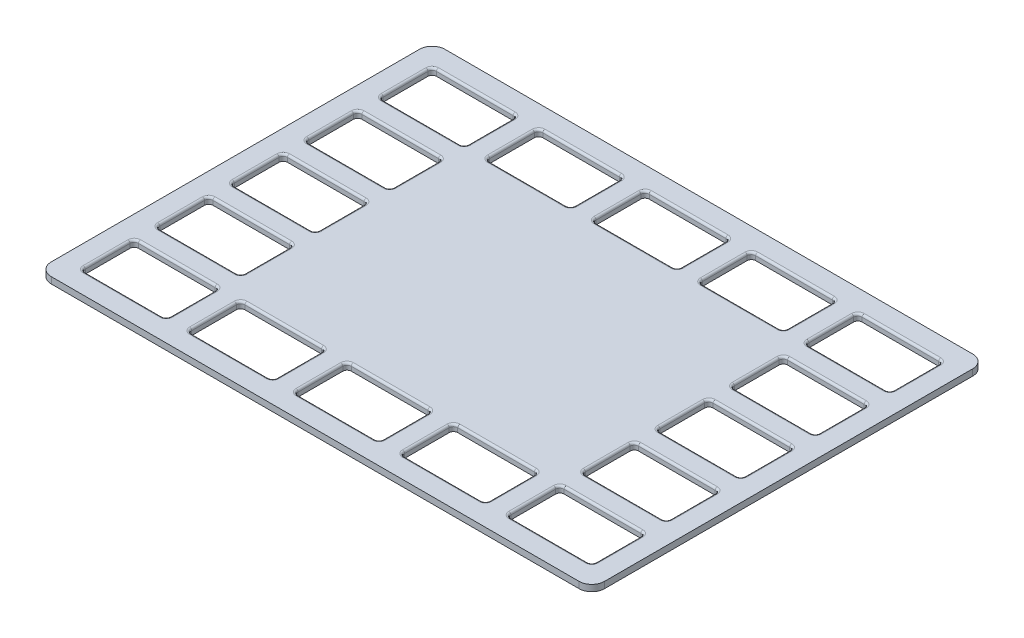
from build123d import *

# Parameters (mm, degrees)
SKETCH1_W                     = 260
SKETCH1_H                     = 185
EXTRUDE1_DEPTH                = 3
FILLET3_R                     = 6
SKETCH2_W                     = 40
SKETCH2_H                     = 25
CUT_EXTRUDE1_DEPTH            = 320.11439955
FILLET1_R                     = 2
FILLET2_R                     = 1
PATTERN_LINEAR_1_COUNT        = 5
PATTERN_LINEAR_1_PITCH        = 50
PATTERN_LINEAR_1_COUNT_DIR2   = 5
PATTERN_LINEAR_1_PITCH_DIR2   = 35
FILLET1_OF_PATTERN_LINEAR_1_R = 2
FILLET2_OF_PATTERN_LINEAR_1_R = 1


with BuildPart() as part:
    # Sketch1 → Extrude1 (new body)
    with BuildSketch(Plane(origin=(0, 0, 0), x_dir=(1, 0, 0), z_dir=(0, 1, 0))):
        with Locations((130, 92.5)):
            Rectangle(SKETCH1_W, SKETCH1_H)
    extrude(amount=EXTRUDE1_DEPTH)

    # Fillet3
    fillet3_edges = [part.edges().sort_by_distance(p)[0] for p in [
        (0, 1.5, -185),
        (260, 1.5, -185),
        (260, 1.5, 0),
        (0, 1.5, 0),
    ]]
    fillet(fillet3_edges, radius=FILLET3_R)

    # Sketch2 → Cut-Extrude1 (cut, through all)
    with BuildSketch(Plane(origin=(0, 3, 0), x_dir=(-1, 0, 0), z_dir=(0, 1, 0))):
        with Locations((-30, -22.5)):
            Rectangle(SKETCH2_W, SKETCH2_H)
    cut_extrude1 = extrude(amount=-CUT_EXTRUDE1_DEPTH, mode=Mode.SUBTRACT)

    # Fillet1
    fillet1_edges = [part.edges().sort_by_distance(p)[0] for p in [
        (10, 1.5, -10),
        (10, 1.5, -35),
        (50, 1.5, -35),
        (50, 1.5, -10),
    ]]
    fillet(fillet1_edges, radius=FILLET1_R)

    # Fillet2
    fillet2_edges = [part.edges().sort_by_distance(p)[0] for p in [
        (30, 3, -35),
        (50, 3, -22.5),
        (30, 3, -10),
        (10, 3, -22.5),
        (49.414213562, 3, -34.414213562),
        (49.414213562, 3, -10.585786438),
        (10.585786438, 3, -10.585786438),
        (10.585786438, 3, -34.414213562),
    ]]
    fillet(fillet2_edges, radius=FILLET2_R)

    # 直線複製排列1: Cut-Extrude1 5 × 5, 9 skipped
    with Locations(*[(i * PATTERN_LINEAR_1_PITCH, 0, -j * PATTERN_LINEAR_1_PITCH_DIR2) for i in range(PATTERN_LINEAR_1_COUNT) for j in range(PATTERN_LINEAR_1_COUNT_DIR2) if (i, j) not in ((0, 0), (1, 1), (1, 2), (1, 3), (2, 1), (2, 2), (2, 3), (3, 1), (3, 2), (3, 3))]):
        add(cut_extrude1, mode=Mode.SUBTRACT)

    # Fillet1 of 直線複製排列1
    fillet1_of_pattern_linear_1_edges = [part.edges().sort_by_distance(p)[0] for p in [
        (10, 1.5, -45),
        (10, 1.5, -70),
        (50, 1.5, -70),
        (50, 1.5, -45),
        (10, 1.5, -80),
        (10, 1.5, -105),
        (50, 1.5, -105),
        (50, 1.5, -80),
        (10, 1.5, -115),
        (10, 1.5, -140),
        (50, 1.5, -140),
        (50, 1.5, -115),
        (10, 1.5, -150),
        (10, 1.5, -175),
        (50, 1.5, -175),
        (50, 1.5, -150),
        (60, 1.5, -10),
        (60, 1.5, -35),
        (100, 1.5, -35),
        (100, 1.5, -10),
        (60, 1.5, -150),
        (60, 1.5, -175),
        (100, 1.5, -175),
        (100, 1.5, -150),
        (110, 1.5, -10),
        (110, 1.5, -35),
        (150, 1.5, -35),
        (150, 1.5, -10),
        (110, 1.5, -150),
        (110, 1.5, -175),
        (150, 1.5, -175),
        (150, 1.5, -150),
        (160, 1.5, -10),
        (160, 1.5, -35),
        (200, 1.5, -35),
        (200, 1.5, -10),
        (160, 1.5, -150),
        (160, 1.5, -175),
        (200, 1.5, -175),
        (200, 1.5, -150),
        (210, 1.5, -10),
        (210, 1.5, -35),
        (250, 1.5, -35),
        (250, 1.5, -10),
        (210, 1.5, -45),
        (210, 1.5, -70),
        (250, 1.5, -70),
        (250, 1.5, -45),
        (210, 1.5, -80),
        (210, 1.5, -105),
        (250, 1.5, -105),
        (250, 1.5, -80),
        (210, 1.5, -115),
        (210, 1.5, -140),
        (250, 1.5, -140),
        (250, 1.5, -115),
        (210, 1.5, -150),
        (210, 1.5, -175),
        (250, 1.5, -175),
        (250, 1.5, -150),
    ]]
    fillet(fillet1_of_pattern_linear_1_edges, radius=FILLET1_OF_PATTERN_LINEAR_1_R)

    # Fillet2 of 直線複製排列1
    fillet2_of_pattern_linear_1_edges = [part.edges().sort_by_distance(p)[0] for p in [
        (30, 3, -70),
        (50, 3, -57.5),
        (30, 3, -45),
        (10, 3, -57.5),
        (49.414213562, 3, -69.414213562),
        (49.414213562, 3, -45.585786438),
        (10.585786438, 3, -45.585786438),
        (10.585786438, 3, -69.414213562),
        (30, 3, -105),
        (50, 3, -92.5),
        (30, 3, -80),
        (10, 3, -92.5),
        (49.414213562, 3, -104.414213562),
        (49.414213562, 3, -80.585786438),
        (10.585786438, 3, -80.585786438),
        (10.585786438, 3, -104.414213562),
        (30, 3, -140),
        (50, 3, -127.5),
        (30, 3, -115),
        (10, 3, -127.5),
        (49.414213562, 3, -139.414213562),
        (49.414213562, 3, -115.585786438),
        (10.585786438, 3, -115.585786438),
        (10.585786438, 3, -139.414213562),
        (30, 3, -175),
        (50, 3, -162.5),
        (30, 3, -150),
        (10, 3, -162.5),
        (49.414213562, 3, -174.414213562),
        (49.414213562, 3, -150.585786438),
        (10.585786438, 3, -150.585786438),
        (10.585786438, 3, -174.414213562),
        (80, 3, -35),
        (100, 3, -22.5),
        (80, 3, -10),
        (60, 3, -22.5),
        (99.414213562, 3, -34.414213562),
        (99.414213562, 3, -10.585786438),
        (60.585786438, 3, -10.585786438),
        (60.585786438, 3, -34.414213562),
        (80, 3, -175),
        (100, 3, -162.5),
        (80, 3, -150),
        (60, 3, -162.5),
        (99.414213562, 3, -174.414213562),
        (99.414213562, 3, -150.585786438),
        (60.585786438, 3, -150.585786438),
        (60.585786438, 3, -174.414213562),
        (130, 3, -35),
        (150, 3, -22.5),
        (130, 3, -10),
        (110, 3, -22.5),
        (149.414213562, 3, -34.414213562),
        (149.414213562, 3, -10.585786438),
        (110.585786438, 3, -10.585786438),
        (110.585786438, 3, -34.414213562),
        (130, 3, -175),
        (150, 3, -162.5),
        (130, 3, -150),
        (110, 3, -162.5),
        (149.414213562, 3, -174.414213562),
        (149.414213562, 3, -150.585786438),
        (110.585786438, 3, -150.585786438),
        (110.585786438, 3, -174.414213562),
        (180, 3, -35),
        (200, 3, -22.5),
        (180, 3, -10),
        (160, 3, -22.5),
        (199.414213562, 3, -34.414213562),
        (199.414213562, 3, -10.585786438),
        (160.585786438, 3, -10.585786438),
        (160.585786438, 3, -34.414213562),
        (180, 3, -175),
        (200, 3, -162.5),
        (180, 3, -150),
        (160, 3, -162.5),
        (199.414213562, 3, -174.414213562),
        (199.414213562, 3, -150.585786438),
        (160.585786438, 3, -150.585786438),
        (160.585786438, 3, -174.414213562),
        (230, 3, -35),
        (250, 3, -22.5),
        (230, 3, -10),
        (210, 3, -22.5),
        (249.414213562, 3, -34.414213562),
        (249.414213562, 3, -10.585786438),
        (210.585786438, 3, -10.585786438),
        (210.585786438, 3, -34.414213562),
        (230, 3, -70),
        (250, 3, -57.5),
        (230, 3, -45),
        (210, 3, -57.5),
        (249.414213562, 3, -69.414213562),
        (249.414213562, 3, -45.585786438),
        (210.585786438, 3, -45.585786438),
        (210.585786438, 3, -69.414213562),
        (230, 3, -105),
        (250, 3, -92.5),
        (230, 3, -80),
        (210, 3, -92.5),
        (249.414213562, 3, -104.414213562),
        (249.414213562, 3, -80.585786438),
        (210.585786438, 3, -80.585786438),
        (210.585786438, 3, -104.414213562),
        (230, 3, -140),
        (250, 3, -127.5),
        (230, 3, -115),
        (210, 3, -127.5),
        (249.414213562, 3, -139.414213562),
        (249.414213562, 3, -115.585786438),
        (210.585786438, 3, -115.585786438),
        (210.585786438, 3, -139.414213562),
        (230, 3, -175),
        (250, 3, -162.5),
        (230, 3, -150),
        (210, 3, -162.5),
        (249.414213562, 3, -174.414213562),
        (249.414213562, 3, -150.585786438),
        (210.585786438, 3, -150.585786438),
        (210.585786438, 3, -174.414213562),
    ]]
    fillet(fillet2_of_pattern_linear_1_edges, radius=FILLET2_OF_PATTERN_LINEAR_1_R)


solid = part.part
